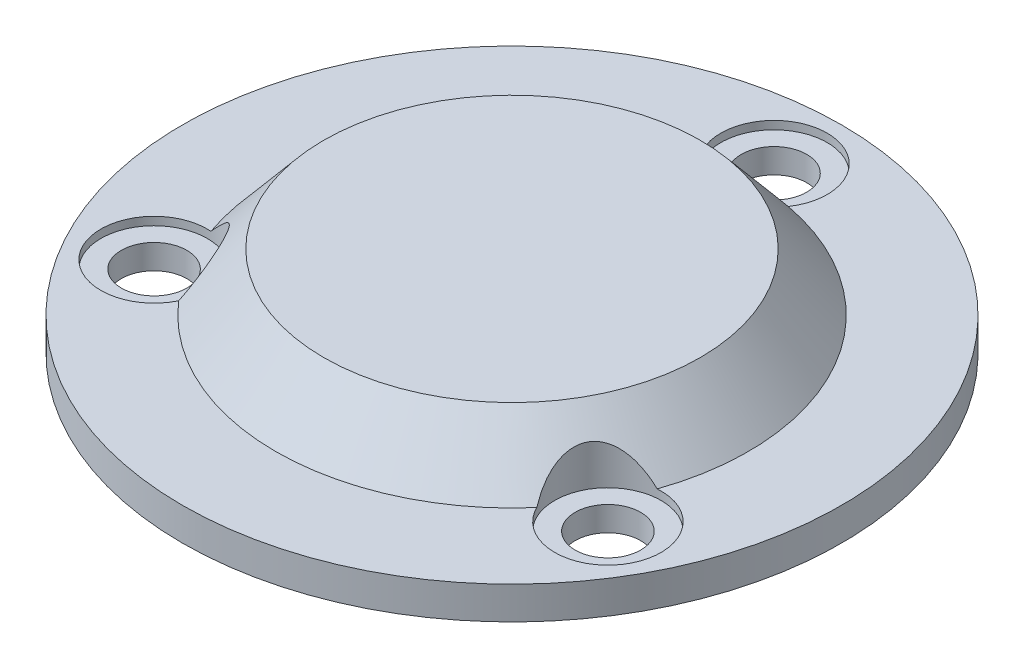
from build123d import *

# Parameters (mm, degrees)
SKETCH2_R               = 4
CUT_EXTRUDE1_DEPTH      = 58.350893629
CUT_EXTRUDE2_DEPTH      = 58.350893629
CUT_EXTRUDE2_DEPTH_BACK = 1
SKETCH3_R               = 6.5


with BuildPart() as part:
    # Sketch1 → Revolve1 (revolve)
    with BuildSketch(Plane.XY, mode=Mode.PRIVATE) as revolve1_sk:
        Polygon((0, 0), (0, 4), (-22.991533214, 4), (-28.865230633, -3), (-40.25, -3), (-40.25, -7), (-27, -7), (-21.126302582, 0), align=None)
    revolve(revolve1_sk.sketch.rotate(Axis((0, 4, 0), (0, -1, 0)), 270), axis=Axis((0, 4, 0), (0, -1, 0)))

    # Sketch2 → Cut-Extrude1 (cut, through all)
    with BuildSketch(Plane(origin=(0, -3, 0), x_dir=(1, 0, 0), z_dir=(0, 1, 0))):
        with Locations(Location((0, 32, 0), (0, 0, 270))):
            Circle(SKETCH2_R)
        with Locations(Location((27.712812921, -16, 0), (0, 0, 270))):
            Circle(SKETCH2_R)
        with Locations(Location((-27.712812921, -16, 0), (0, 0, 270))):
            Circle(SKETCH2_R)
    extrude(amount=-CUT_EXTRUDE1_DEPTH, mode=Mode.SUBTRACT)

    # Sketch3 → Cut-Extrude2 (cut, two sides: drawn at the far end of the back side and taken through both)
    with BuildSketch(Plane(origin=(0, -3, 0), x_dir=(1, 0, 0), z_dir=(0, 1, 0)).offset(-CUT_EXTRUDE2_DEPTH_BACK)):
        with Locations(Location((0, 32, 0), (0, 0, 325.92949513))):
            Circle(SKETCH3_R)
        with Locations(Location((27.712812921, -16, 0), (0, 0, 94.070504949))):
            Circle(SKETCH3_R)
        with Locations(Location((-27.712812921, -16, 0), (0, 0, 85.92949513))):
            Circle(SKETCH3_R)
    extrude(amount=CUT_EXTRUDE2_DEPTH + CUT_EXTRUDE2_DEPTH_BACK, mode=Mode.SUBTRACT)


solid = part.part
